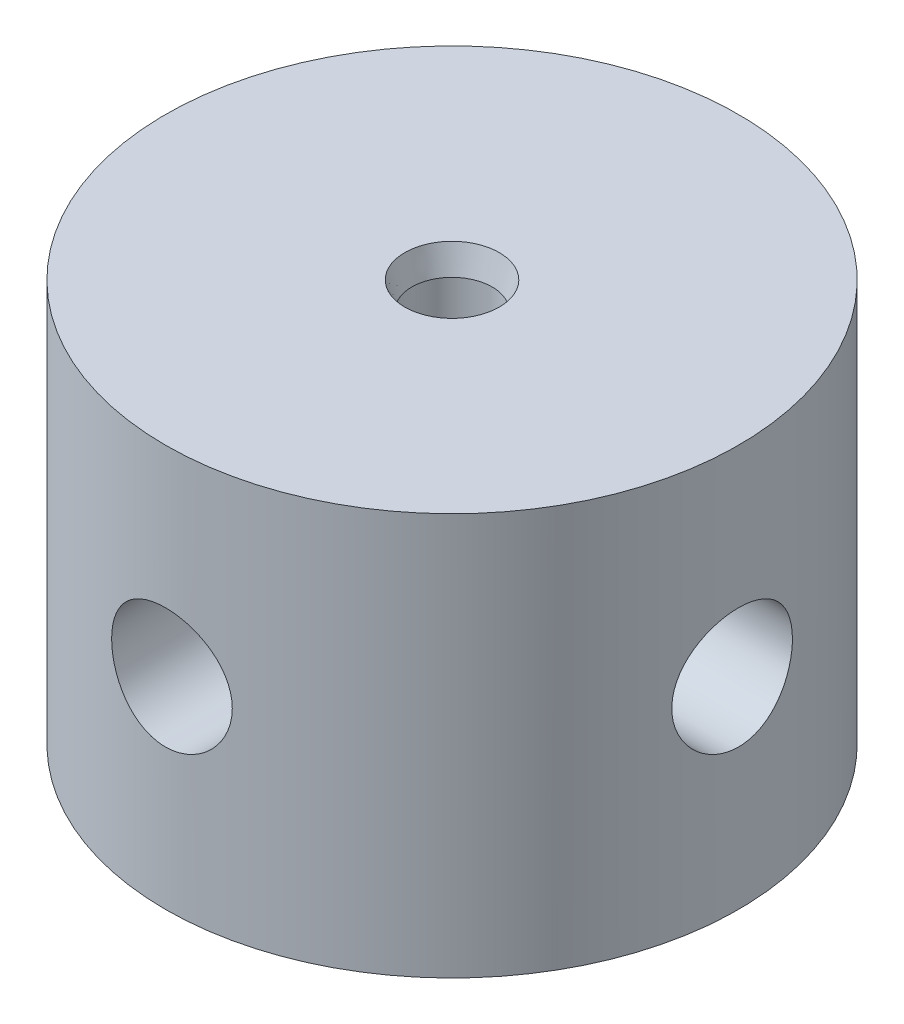
from build123d import *

# Parameters (mm, degrees)
SKETCH2_R          = 3
CUT_EXTRUDE1_DEPTH = 9
CIRPATTERN1_COUNT  = 4


with BuildPart() as part:
    # Sketch1 → Revolve1 (revolve)
    with BuildSketch(Plane.XY):
        Polygon((-2, 7.705702305), (-2, -7.705702305), (-14.25, -10.988079912), (-14.25, 9.011920088), (-2.35, 9.011920088), align=None)
    revolve(axis=Axis((0, 20.798274686, 0), (0, -1, 0)))

    # Sketch2 → Cut-Extrude1 (cut)
    with BuildSketch(Plane(origin=(14.25, 0, 0), x_dir=(0, 0, -1), z_dir=(1, 0, 0))):
        with Locations((0, -0.988079912)):
            Circle(SKETCH2_R)
    cut_extrude1 = extrude(amount=-CUT_EXTRUDE1_DEPTH, mode=Mode.SUBTRACT)

    # CirPattern1: Cut-Extrude1 ×4 about axis
    cirpattern1_axis = Axis((0, -10.988079912, 0), (0, 1, 0))
    for i in range(1, CIRPATTERN1_COUNT):
        add(cut_extrude1.rotate(cirpattern1_axis, i * 360 / CIRPATTERN1_COUNT), mode=Mode.SUBTRACT)


solid = part.part
